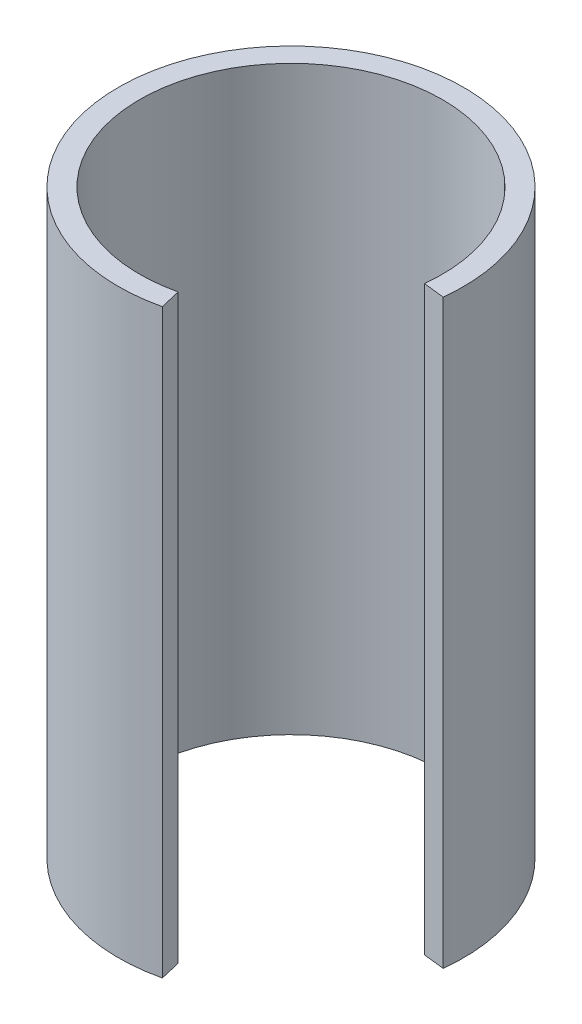
from build123d import *

# Parameters (mm, degrees)
BOSS_EXTRUDE1_DEPTH = 150


with BuildPart() as part:
    # Sketch1 → Boss-Extrude1 (new body)
    with BuildSketch(Plane(origin=(0, 0, 0), x_dir=(1, 0, 0), z_dir=(0, 1, 0))):
        with BuildLine():
            Line((38.803912156, -4.377088234), (44.245630671, -4.990915057))
            ThreePointArc((44.245630671, -4.990915057), (-33.287140172, 29.57281464), (10.166842993, -43.349975434))
            Line((10.166842993, -43.349975434), (8.91643483, -38.018412512))
            ThreePointArc((8.91643483, -38.018412512), (-29.193193623, 25.935688657), (38.803912156, -4.377088234))
        make_face()
    extrude(amount=BOSS_EXTRUDE1_DEPTH)


solid = part.part
